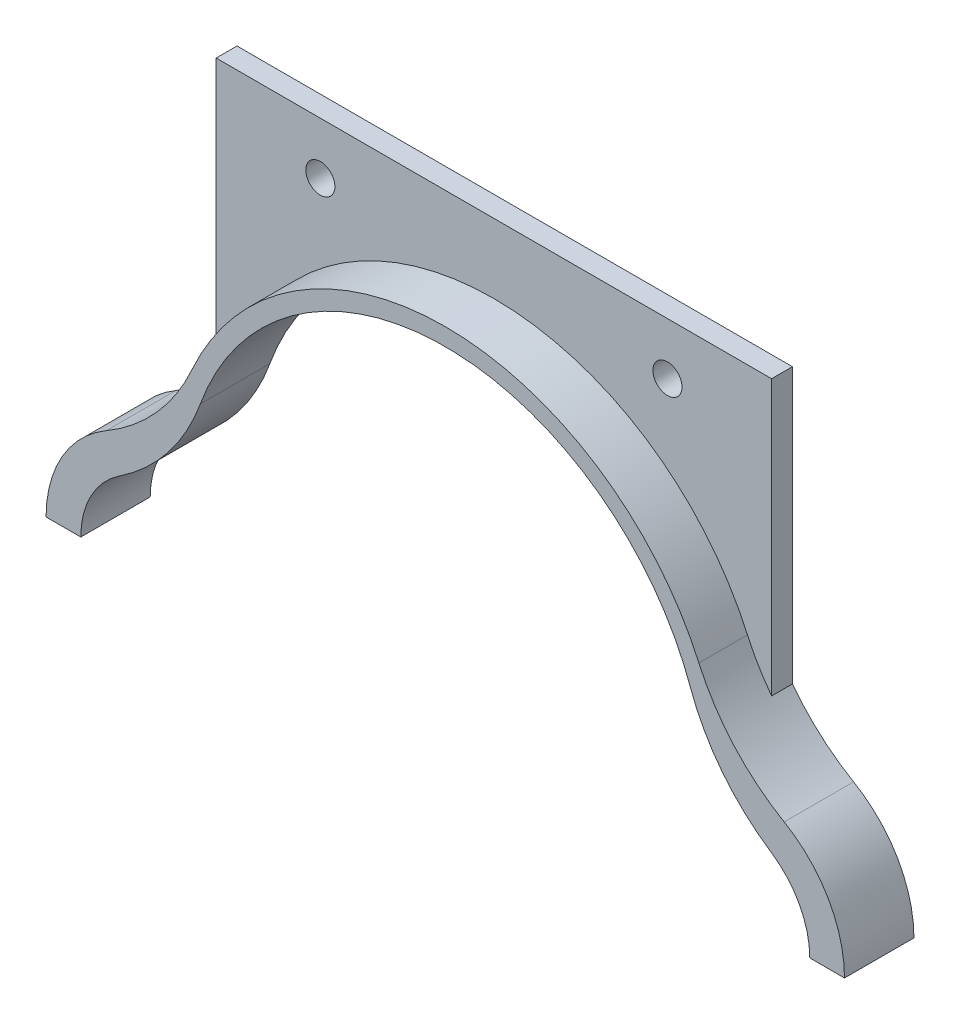
from build123d import *

# Parameters (mm, degrees)
EXTRUDE_1_DEPTH     = 10
EXTRUDE_2_DEPTH     = 3
SKETCH_3_R          = 2.1
CUT_EXTRUDE_1_DEPTH = 65.41273166075166
EXTRUDE_START       = -10
EXTRUDE_5_DEPTH     = 10
FILLET_1_R          = 30
FILLET_2_R          = 30


with BuildPart() as part:
    # 草圖1 → 填料-伸長1 (new body)
    with BuildSketch(Plane.XY):
        with BuildLine():
            Line((-39.999999999999964, -7.633e-14), (-37.499999999999964, -7.633e-14))
            ThreePointArc((-37.499999999999964, -7.633e-14), (-4.02e-14, 37.499999999999964), (37.5, 0))
            Line((37.5, 0), (40, 0))
            ThreePointArc((40, 0), (-4.288e-14, 39.999999999999964), (-39.999999999999964, -7.633e-14))
        make_face()
    extrude(amount=EXTRUDE_1_DEPTH)

    # 草圖2 → 填料-伸長2 (add)
    with BuildSketch(Plane(origin=(0, 0, 0), x_dir=(-1, 0, 0), z_dir=(0, 0, -1))):
        with BuildLine():
            Line((-39.99999999999998, -2.7932e-13), (-40, 50))
            Line((-40, 50), (40, 50))
            Line((40, 50), (39.999999999999964, -7.633e-14))
            ThreePointArc((39.999999999999964, -7.633e-14), (-1.1393e-13, 39.99999999999998), (-39.99999999999998, -2.7932e-13))
        make_face()
    extrude(amount=-EXTRUDE_2_DEPTH)

    # 草圖3 → 除料-伸長1 (cut, through all)
    with BuildSketch(Plane.XY.offset(3)):
        with Locations((-25, 42.5)):
            Circle(SKETCH_3_R)
        with Locations((25, 42.5)):
            Circle(SKETCH_3_R)
    extrude(amount=-CUT_EXTRUDE_1_DEPTH, mode=Mode.SUBTRACT)

    # 草圖4 → 填料-伸長5 (add)
    with BuildSketch(Plane(origin=(0, 0, 0), x_dir=(-1, 0, 0), z_dir=(0, 0, -1)).offset(EXTRUDE_START)):
        with BuildLine():
            Line((52.49999999999998, -12.500000000000076), (57.49999999999997, -12.500000000000076))
            ThreePointArc((57.49999999999997, -12.500000000000076), (52.37436867076461, -0.12563132923555287), (40.00000000000013, 4.999999999999924))
            Line((39.999999999999964, 4.999999999999924), (39.999999999999964, -7.633e-14))
            ThreePointArc((39.999999999999964, -7.461e-14), (48.83883476483181, -3.6611652351682356), (52.49999999999998, -12.500000000000078))
        make_face()
        with BuildLine():
            Line((39.999999999999964, -7.633e-14), (39.999999999999964, 4.999999999999924))
            ThreePointArc((40.00000000000013, 4.999999999999924), (39.84330526776641, 4.999298464821022), (39.686623098603214, 4.9971939155302305))
            ThreePointArc((39.68662309860321, 4.997193915530231), (39.92157890129177, 2.5035051483740323), (39.99999999999996, -2.809e-14))
        make_face()
    extrude_5 = extrude(amount=EXTRUDE_5_DEPTH)

    # 鏡射1: 填料-伸長5 across plane
    add(extrude_5.mirror(Plane(origin=(0, 0, 0), x_dir=(0, 0, 1), z_dir=(1, 0, 0))))

    # 圓角1
    fillet_1_edges = [part.edges().sort_by_distance(p)[0] for p in [
        (37.5, 4.27e-15, 5),
        (-37.49999999999997, -7.633e-14, 5),
    ]]
    fillet(fillet_1_edges, radius=FILLET_1_R)

    # 圓角2
    fillet_2_edges = [part.edges().sort_by_distance(p)[0] for p in [
        (-39.68662309860321, 4.997193915530232, 6.5),
        (39.68662309860321, 4.997193915530232, 6.5),
    ]]
    fillet(fillet_2_edges, radius=FILLET_2_R)


solid = part.part
